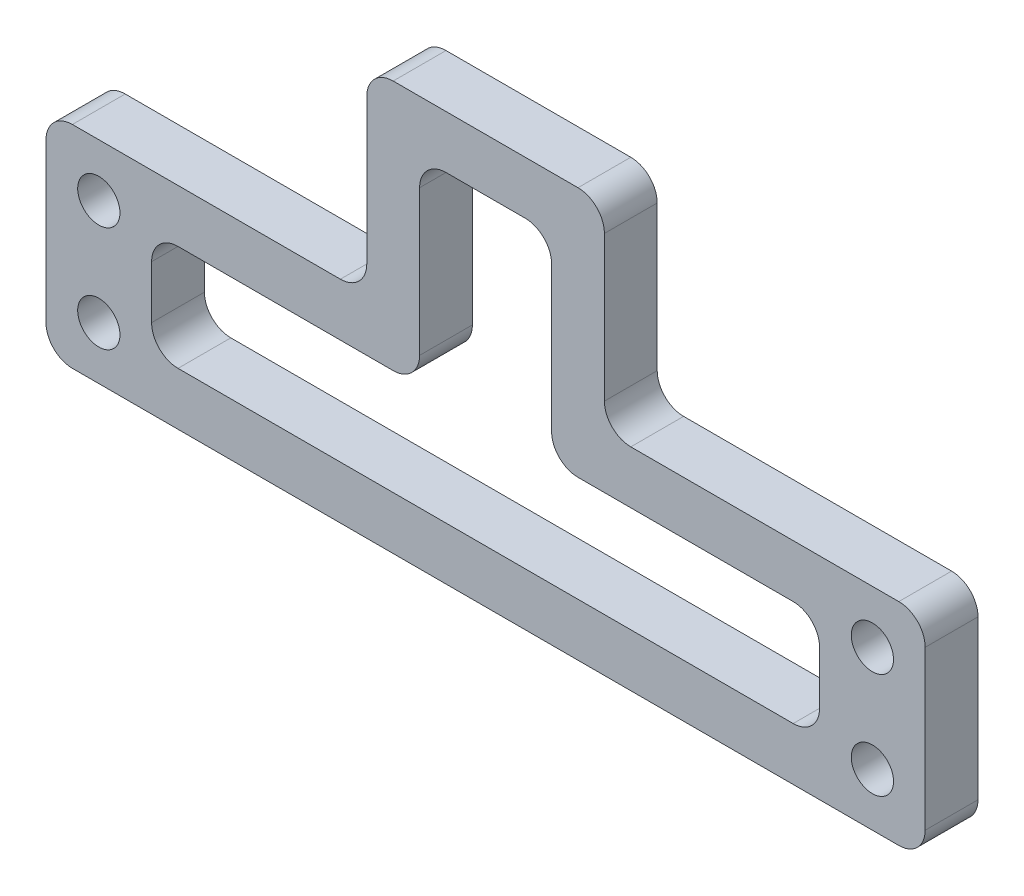
from build123d import *

# Parameters (mm, degrees)
SKETCH_1_R      = 1.6
EXTRUDE_1_DEPTH = 4
FILLET_1_R      = 2


with BuildPart() as part:
    # 草图1 → 凸台-拉伸1 (new body)
    with BuildSketch(Plane.XY):
        Polygon((0, 0), (66.6, 0), (66.6, 16), (42.3, 16), (42.3, 31), (24.3, 31), (24.3, 16), (0, 16), align=None)
        with Locations((4, 4)):
            Circle(SKETCH_1_R, mode=Mode.SUBTRACT)
        with Locations((4, 12)):
            Circle(SKETCH_1_R, mode=Mode.SUBTRACT)
        with Locations(Location((62.6, 12, 0), (0, 0, 180))):
            Circle(SKETCH_1_R, mode=Mode.SUBTRACT)
        with Locations(Location((62.6, 4, 0), (0, 0, 180))):
            Circle(SKETCH_1_R, mode=Mode.SUBTRACT)
        Polygon((8, 12), (28.3, 12), (28.3, 27), (38.3, 27), (38.3, 12), (58.6, 12), (58.6, 4), (8, 4), align=None, mode=Mode.SUBTRACT)
    extrude(amount=EXTRUDE_1_DEPTH)

    # 圆角1
    fillet_1_edges = [part.edges().sort_by_distance(p)[0] for p in [
        (0, 16, 2),
        (24.3, 16, 2),
        (24.3, 31, 2),
        (42.3, 31, 2),
        (42.3, 16, 2),
        (66.6, 16, 2),
        (66.6, 0, 2),
        (0, 0, 2),
        (58.6, 4, 2),
        (58.6, 12, 2),
        (38.3, 12, 2),
        (38.3, 27, 2),
        (28.3, 27, 2),
        (28.3, 12, 2),
        (8, 12, 2),
        (8, 4, 2),
    ]]
    fillet(fillet_1_edges, radius=FILLET_1_R)


solid = part.part
